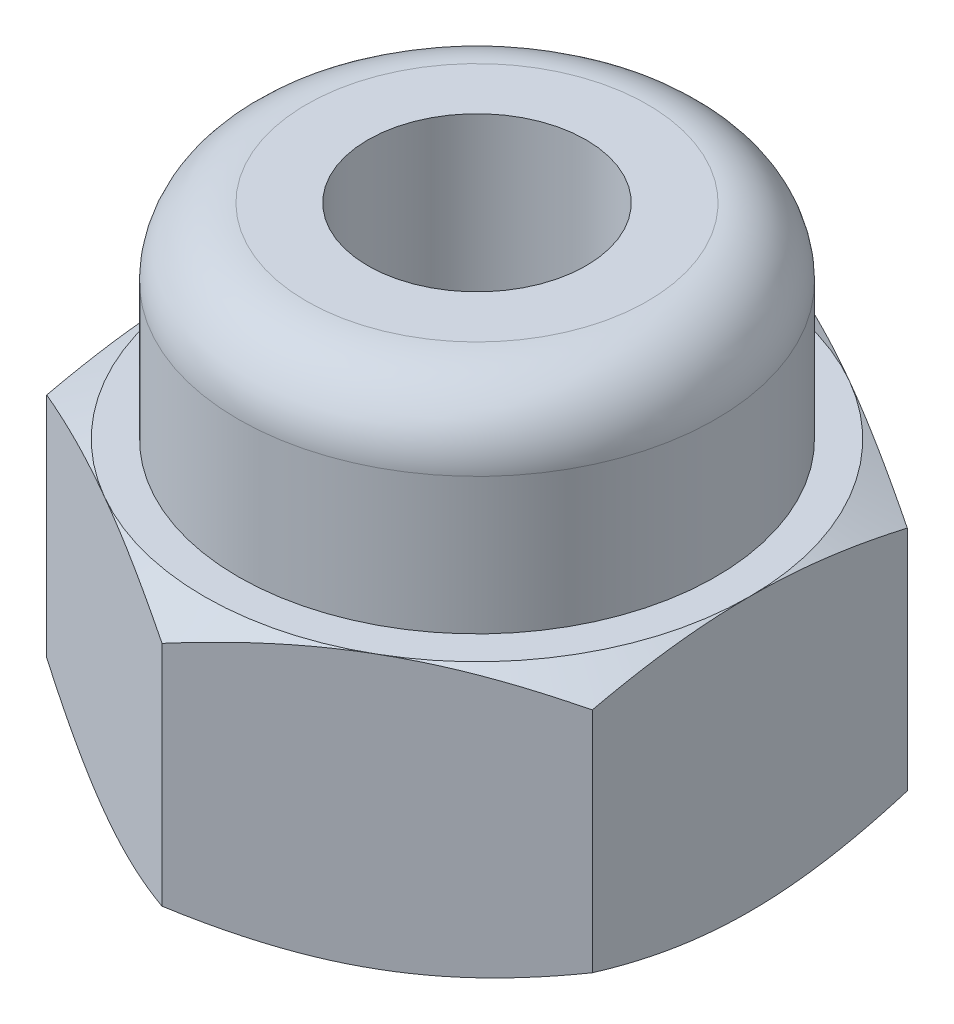
from build123d import *

# Parameters (mm, degrees)
EXTRUDE_1_DEPTH     = 2
SKETCH_2_R          = 1.75
EXTRUDE_2_DEPTH     = 1.5
FILLET_1_R          = 0.5
SKETCH_3_R          = 0.8
CUT_EXTRUDE_1_DEPTH = 3.5


with BuildPart() as part:
    # 草图1 → 凸台-拉伸1 (new body)
    with BuildSketch(Plane(origin=(0, 0, 0), x_dir=(1, 0, 0), z_dir=(0, 1, 0))):
        Polygon((2, 1.154700538), (0, 2.309401077), (-2, 1.154700538), (-2, -1.154700538), (0, -2.309401077), (2, -1.154700538), align=None)
    extrude(amount=EXTRUDE_1_DEPTH)

    # 草图2 → 凸台-拉伸2 (add)
    with BuildSketch(Plane(origin=(0, 2, 0), x_dir=(1, 0, 0), z_dir=(0, 1, 0))):
        with Locations(Location((0, 0, 0), (0, 0, 270))):
            Circle(SKETCH_2_R)
    extrude(amount=EXTRUDE_2_DEPTH)

    # 圆角1
    fillet_1_edges = [part.edges().sort_by_distance(p)[0] for p in [
        (0, 3.5, -1.75),
    ]]
    fillet(fillet_1_edges, radius=FILLET_1_R)

    # 草图3 → 切除-拉伸1 (cut)
    with BuildSketch(Plane.XZ):
        with Locations(Location((0, 0, 0), (0, 0, 270))):
            Circle(SKETCH_3_R)
    extrude(amount=-CUT_EXTRUDE_1_DEPTH, mode=Mode.SUBTRACT)

    # 草图4 → 切除-旋转1 (revolve, cut)
    with BuildSketch(Plane.XY):
        Polygon((3.454158992, 0), (3.454158992, 0.884050335), (2, 0), align=None)
        Polygon((2, 2), (3.454158992, 2), (3.454158992, 1.328835078), align=None)
    revolve(axis=Axis((0, 0, 0), (0, 1, 0)), mode=Mode.SUBTRACT)


solid = part.part
